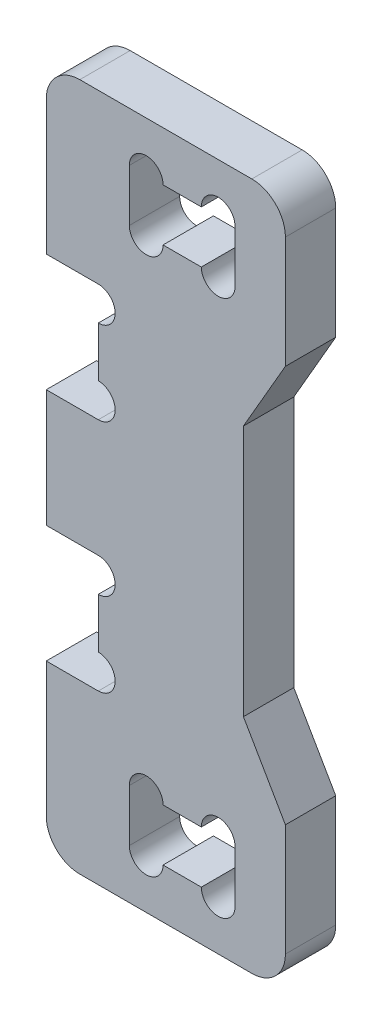
from build123d import *

# Parameters (mm, degrees)
EXTRUDE_1_DEPTH = 3
FILLET_1_R      = 2


with BuildPart() as part:
    # 草图1 → 凸台-拉伸1 (new body)
    with BuildSketch(Plane.XY):
        with BuildLine():
            Line((7.125, 20.5), (-7.125, 20.5))
            Line((-7.125, 20.5), (-7.125, 10.5))
            Line((-7.125, 10.5), (-4.025, 10.5))
            ThreePointArc((-4.025, 10.5), (-3.314357685, 10.205642315), (-3.02, 9.495))
            ThreePointArc((-3.02, 9.495), (-3.314357685, 8.784357685), (-4.025, 8.49))
            Line((-4.025, 8.49), (-4.025, 5.51))
            ThreePointArc((-4.025, 5.51), (-3.314357685, 5.215642315), (-3.02, 4.505))
            ThreePointArc((-3.02, 4.505), (-3.314357685, 3.794357685), (-4.025, 3.5))
            Line((-4.025, 3.5), (-7.125, 3.5))
            Line((-7.125, 3.5), (-7.125, -3.5))
            Line((-7.125, -3.5), (-4.025, -3.5))
            ThreePointArc((-4.025, -3.5), (-3.314357685, -3.794357685), (-3.02, -4.505))
            ThreePointArc((-3.02, -4.505), (-3.314357685, -5.215642315), (-4.025, -5.51))
            Line((-4.025, -5.51), (-4.025, -8.49))
            ThreePointArc((-4.025, -8.49), (-3.314357685, -8.784357685), (-3.02, -9.495))
            ThreePointArc((-3.02, -9.495), (-3.314357685, -10.205642315), (-4.025, -10.5))
            Line((-4.025, -10.5), (-7.125, -10.5))
            Line((-7.125, -10.5), (-7.125, -20.5))
            Line((-7.125, -20.5), (7.125, -20.5))
            Line((7.125, -20.5), (7.125, -11.830127019))
            Line((7.125, -11.830127019), (4.625, -7.5))
            Line((4.625, -7.5), (4.625, 7.5))
            Line((4.625, 7.5), (7.125, 11.830127019))
            Line((7.125, 11.830127019), (7.125, 20.5))
        make_face()
        with BuildLine():
            Line((2.115, -17.55), (-0.165, -17.55))
            ThreePointArc((-0.165, -17.55), (-1.17, -18.555), (-2.175, -17.55))
            Line((-2.175, -17.55), (-2.175, -14.45))
            ThreePointArc((-2.175, -14.45), (-1.17, -13.445), (-0.165, -14.45))
            Line((-0.165, -14.45), (2.115, -14.45))
            ThreePointArc((2.115, -14.45), (3.12, -13.445), (4.125, -14.45))
            Line((4.125, -14.45), (4.125, -17.55))
            ThreePointArc((4.125, -17.55), (3.12, -18.555), (2.115, -17.55))
        make_face(mode=Mode.SUBTRACT)
        with BuildLine():
            Line((2.115, 14.45), (-0.165, 14.45))
            ThreePointArc((-0.165, 14.45), (-1.17, 13.445), (-2.175, 14.45))
            Line((-2.175, 14.45), (-2.175, 17.55))
            ThreePointArc((-2.175, 17.55), (-1.17, 18.555), (-0.165, 17.55))
            Line((-0.165, 17.55), (2.115, 17.55))
            ThreePointArc((2.115, 17.55), (3.12, 18.555), (4.125, 17.55))
            Line((4.125, 17.55), (4.125, 14.45))
            ThreePointArc((4.125, 14.45), (3.12, 13.445), (2.115, 14.45))
        make_face(mode=Mode.SUBTRACT)
    extrude(amount=EXTRUDE_1_DEPTH)

    # 圆角1
    fillet_1_edges = [part.edges().sort_by_distance(p)[0] for p in [
        (-7.125, 20.5, 1.5),
        (7.125, 20.5, 1.5),
        (7.125, -20.5, 1.5),
        (-7.125, -20.5, 1.5),
    ]]
    fillet(fillet_1_edges, radius=FILLET_1_R)


solid = part.part
